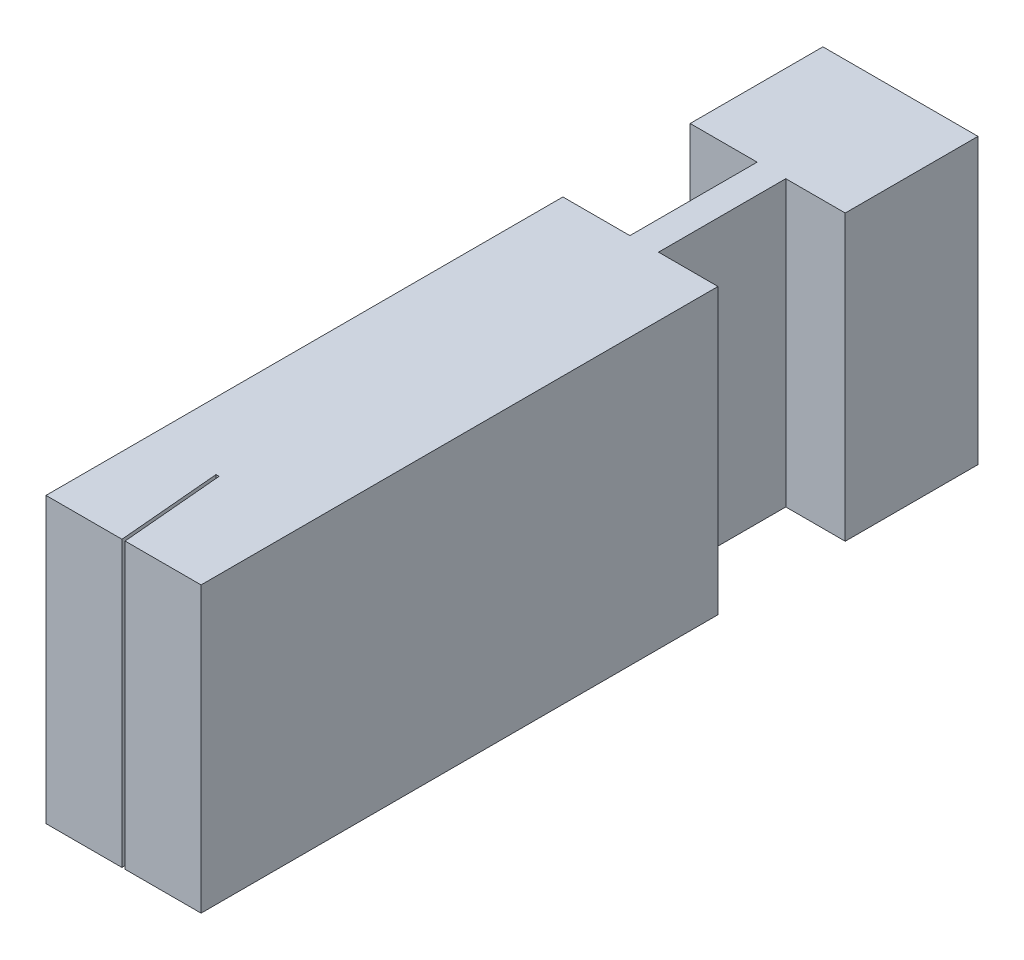
from build123d import *

# Parameters (mm, degrees)
BOSS_EXTRUDE1_DEPTH = 55


with BuildPart() as part:
    # Sketch1 → Boss-Extrude1 (new body)
    with BuildSketch(Plane(origin=(0, 0, 0), x_dir=(1, 0, 0), z_dir=(0, 1, 0))):
        Polygon((14.7, 0), (12.956885145, 19.923893962), (13.556885145, 19.923893962), (15.3, 0), (30, 0), (29.999997553, 100), (18.501297604, 100), (18.501297604, 124.616050596), (29.999997553, 124.616050596), (29.999997553, 150.30281184), (0, 150.30281184), (0, 124.616050596), (12.956885145, 124.616050596), (12.956885145, 100), (-2.447e-06, 100), (0, 0), align=None)
    extrude(amount=BOSS_EXTRUDE1_DEPTH)


solid = part.part
